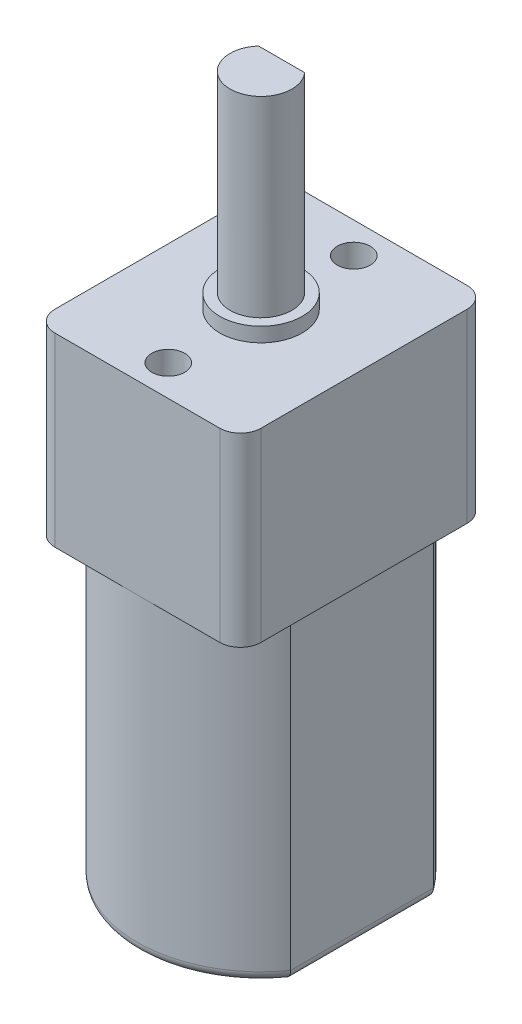
from build123d import *

# Parameters (mm, degrees)
SKETCH_1_W      = 10
SKETCH_1_H      = 12
SKETCH_1_R      = 2
SKETCH_1_R_2    = 0.8
EXTRUDE_1_DEPTH = 9
SKETCH_1_3_R    = 2
SKETCH_1_3_R_2  = 1.5
EXTRUDE_3_DEPTH = 9.7
EXTRUDE_4_DEPTH = 19
SKETCH_1_5_R    = 1.5
EXTRUDE_5_DEPTH = 10
EXTRUDE_6_DEPTH = 15.1
SKETCH_4_R      = 2.5
SKETCH_4_R_2    = 0.75
EXTRUDE_7_DEPTH = 1.2
FILLET_1_R      = 1
FILLET_2_R      = 0.5


with BuildPart() as part:
    # 草图1 → 凸台-拉伸1 (new body)
    with BuildSketch(Plane(origin=(0, 0, 0), x_dir=(1, 0, 0), z_dir=(0, 1, 0))):
        Rectangle(SKETCH_1_W, SKETCH_1_H)
        with Locations(Location((0, 0, 0), (0, 0, 270))):
            Circle(SKETCH_1_R, mode=Mode.SUBTRACT)
        with Locations(Location((0, -4.5, 0), (0, 0, 270))):
            Circle(SKETCH_1_R_2, mode=Mode.SUBTRACT)
        with Locations(Location((0, 4.5, 0), (0, 0, 270))):
            Circle(SKETCH_1_R_2, mode=Mode.SUBTRACT)
    extrude(amount=EXTRUDE_1_DEPTH)

    # 草图1<3> → 凸台-拉伸3 (add)
    with BuildSketch(Plane(origin=(0, 0, 0), x_dir=(1, 0, 0), z_dir=(0, 1, 0))):
        with Locations(Location((0, 0, 0), (0, 0, 270))):
            Circle(SKETCH_1_3_R)
        with Locations(Location((0, 0, 0), (0, 0, 270))):
            Circle(SKETCH_1_3_R_2, mode=Mode.SUBTRACT)
    extrude(amount=EXTRUDE_3_DEPTH)

    # 草图1<4> → 凸台-拉伸4 (add)
    with BuildSketch(Plane(origin=(0, 0, 0), x_dir=(1, 0, 0), z_dir=(0, 1, 0))):
        with BuildLine():
            Line((1.118033989, 1), (-1.118033989, 1))
            ThreePointArc((-1.118033989, 1), (-0.535233135, -1.401258538), (1.5, 0))
            ThreePointArc((1.5, 0), (1.401258538, 0.535233135), (1.118033989, 1))
        make_face()
    extrude(amount=EXTRUDE_4_DEPTH)

    # 草图1<5> → 凸台-拉伸5 (add)
    with BuildSketch(Plane(origin=(0, 0, 0), x_dir=(1, 0, 0), z_dir=(0, 1, 0))):
        with Locations(Location((0, 0, 0), (0, 0, 138.189685104))):
            Circle(SKETCH_1_5_R)
    extrude(amount=EXTRUDE_5_DEPTH)

    # 草图3 → 凸台-拉伸6 (add)
    with BuildSketch(Plane.XZ):
        with BuildLine():
            Line((4.9, -3.462657939), (4.9, 3.462657939))
            ThreePointArc((4.9, 3.462657939), (0, 6), (-4.9, 3.462657939))
            Line((-4.9, 3.462657939), (-4.9, -3.462657939))
            ThreePointArc((-4.9, -3.462657939), (0, -6), (4.9, -3.462657939))
        make_face()
    extrude(amount=EXTRUDE_6_DEPTH)

    # 草图4 → 凸台-拉伸7 (add)
    with BuildSketch(Plane.XZ.offset(15.1)):
        with Locations(Location((0, 0, 0), (0, 0, 270))):
            Circle(SKETCH_4_R)
        with Locations(Location((0, 0, 0), (0, 0, 270))):
            Circle(SKETCH_4_R_2, mode=Mode.SUBTRACT)
    extrude(amount=EXTRUDE_7_DEPTH)

    # 圆角1
    fillet_1_edges = [part.edges().sort_by_distance(p)[0] for p in [
        (5, 4.5, 6),
        (-5, 4.5, 6),
        (-5, 4.5, -6),
        (5, 4.5, -6),
    ]]
    fillet(fillet_1_edges, radius=FILLET_1_R)

    # 圆角2
    fillet_2_edges = [part.edges().sort_by_distance(p)[0] for p in [
        (0, -15.1, 6),
        (-4.9, -15.1, 0),
        (0, -15.1, -6),
        (4.9, -15.1, 0),
    ]]
    fillet(fillet_2_edges, radius=FILLET_2_R)


solid = part.part
